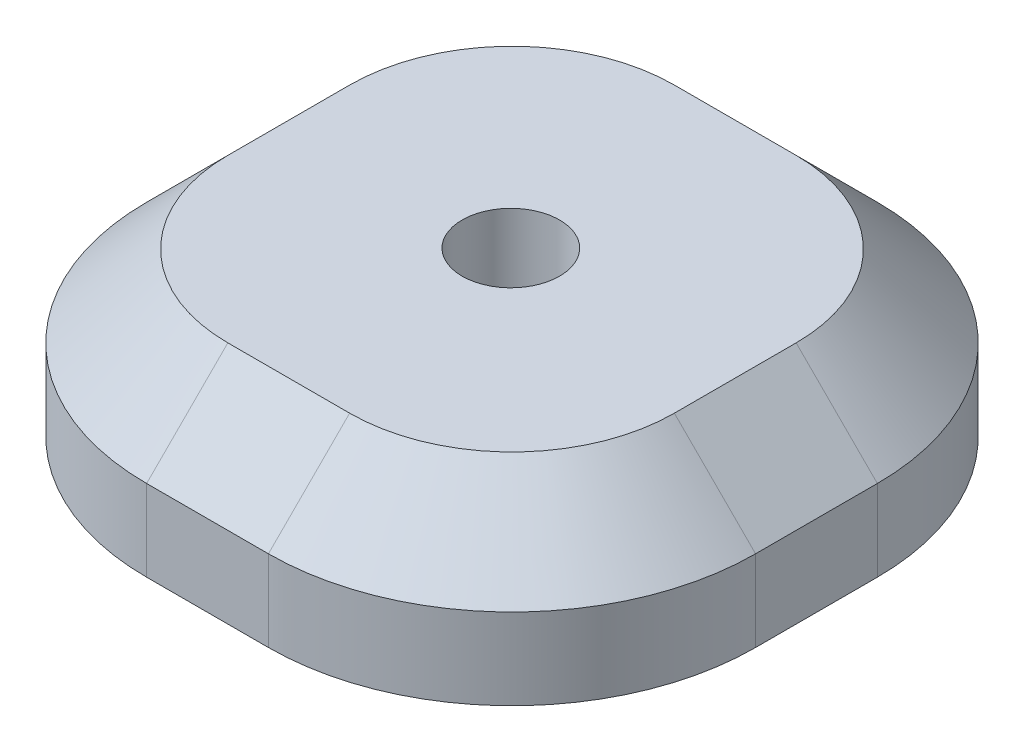
from build123d import *

# Parameters (mm, degrees)
SKETCH_1_W       = 75
SKETCH_1_H       = 75
EXTRUDE_1_DEPTH  = 20
FILLET_1_R       = 30
CHAMFER_1_SIZE   = 10
F_20_0MM_1_D     = 12
F_20_0MM_1_DEPTH = 10
F_20_0MM_1_TIP   = 3.605163714
F_20_0MM_2_D     = 12
F_20_0MM_2_DEPTH = 10
F_20_0MM_2_TIP   = 3.605163714


with BuildPart() as part:
    # 草圖1 → 填料-伸長1 (new body)
    with BuildSketch(Plane(origin=(0, 0, 0), x_dir=(1, 0, 0), z_dir=(0, 1, 0))):
        with Locations((37.5, 37.5)):
            Rectangle(SKETCH_1_W, SKETCH_1_H)
    extrude(amount=EXTRUDE_1_DEPTH)

    # 圓角1
    fillet_1_edges = [part.edges().sort_by_distance(p)[0] for p in [
        (0, 10, -75),
        (75, 10, -75),
        (75, 10, 0),
        (0, 10, 0),
    ]]
    fillet(fillet_1_edges, radius=FILLET_1_R)

    # 導角1
    chamfer_1_edges = [part.edges().sort_by_distance(p)[0] for p in [
        (0, 20, -37.5),
        (37.5, 20, -75),
        (37.5, 20, 0),
        (75, 20, -37.5),
        (8.786796564, 20, -8.786796564),
        (66.213203436, 20, -8.786796564),
        (66.213203436, 20, -66.213203436),
        (8.786796564, 20, -66.213203436),
    ]]
    chamfer(chamfer_1_edges, length=CHAMFER_1_SIZE)

    # Ø20.0mm 定位孔1
    with Locations(Plane(origin=(25, 0, -25), x_dir=(0, 0, -1), z_dir=(0, -1, 0))):
        with Locations((0, 0), (0, 25), (25, 25), (25, 0)):
            Hole(F_20_0MM_1_D / 2, depth=F_20_0MM_1_DEPTH)
            with Locations((0, 0, -(F_20_0MM_1_DEPTH + F_20_0MM_1_TIP / 2))):  # 118° drill point
                Cone(0, F_20_0MM_1_D / 2, F_20_0MM_1_TIP, mode=Mode.SUBTRACT)

    # Ø20.0mm 定位孔2
    with Locations(Plane(origin=(0, 20, 0), x_dir=(1, 0, 0), z_dir=(0, 1, 0))):
        with Locations((37.318018893, 37.539608609)):
            Hole(F_20_0MM_2_D / 2, depth=F_20_0MM_2_DEPTH)
            with Locations((0, 0, -(F_20_0MM_2_DEPTH + F_20_0MM_2_TIP / 2))):  # 118° drill point
                Cone(0, F_20_0MM_2_D / 2, F_20_0MM_2_TIP, mode=Mode.SUBTRACT)


solid = part.part
